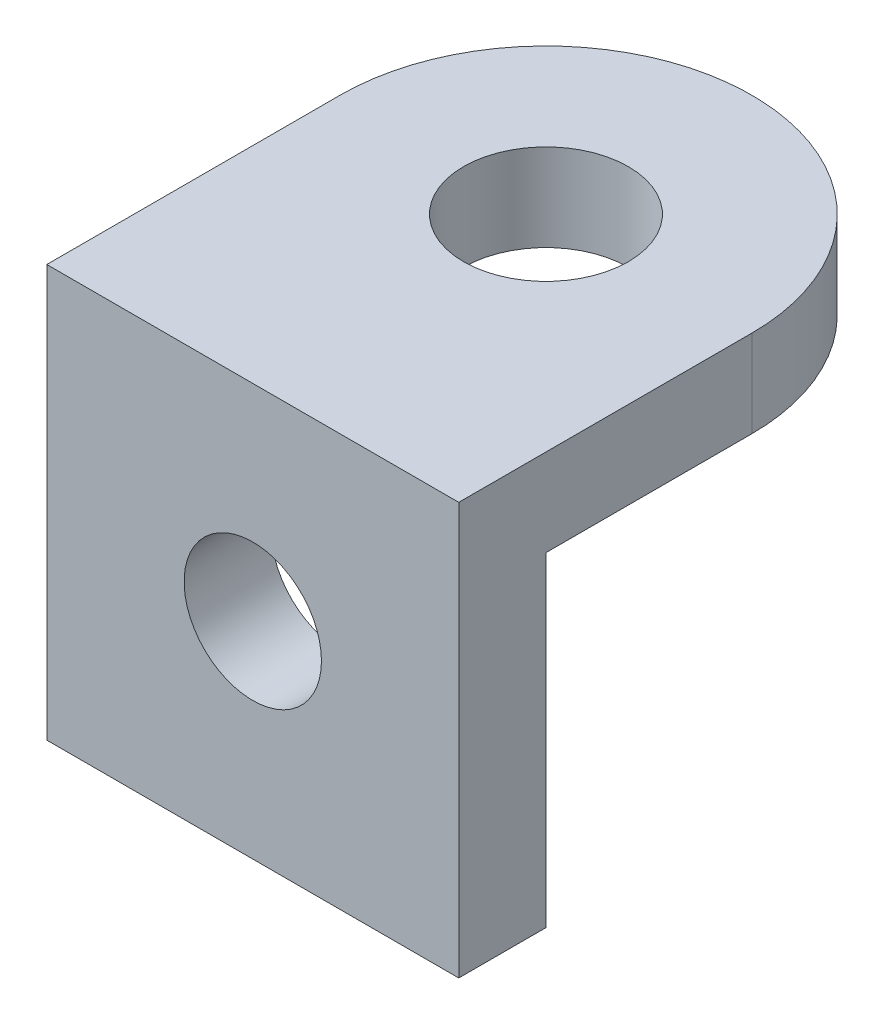
from build123d import *

# Parameters (mm, degrees)
SKETCH1_W           = 15
SKETCH1_H           = 15
SKETCH1_R           = 2.5
BOSS_EXTRUDE1_DEPTH = 3.175
SKETCH2_R           = 3
BOSS_EXTRUDE2_DEPTH = 3.175


with BuildPart() as part:
    # Sketch1 → Boss-Extrude1 (new body)
    with BuildSketch(Plane.XY):
        with Locations((0, -7.5)):
            Rectangle(SKETCH1_W, SKETCH1_H)
        with Locations((0, -7.5)):
            Circle(SKETCH1_R, mode=Mode.SUBTRACT)
    extrude(amount=BOSS_EXTRUDE1_DEPTH)

    # Sketch2 → Boss-Extrude2 (add)
    with BuildSketch(Plane(origin=(0, 0, 0), x_dir=(1, 0, 0), z_dir=(0, 1, 0))):
        with BuildLine():
            Line((-7.5, 7.5), (-7.5, 0))
            Line((-7.5, 0), (7.5, 0))
            Line((7.5, 0), (7.5, 7.5))
            ThreePointArc((7.5, 7.5), (0, 15), (-7.5, 7.5))
        make_face()
        with Locations(Location((0, 7.5, 0), (0, 0, 270))):
            Circle(SKETCH2_R, mode=Mode.SUBTRACT)
    extrude(amount=-BOSS_EXTRUDE2_DEPTH)


solid = part.part
